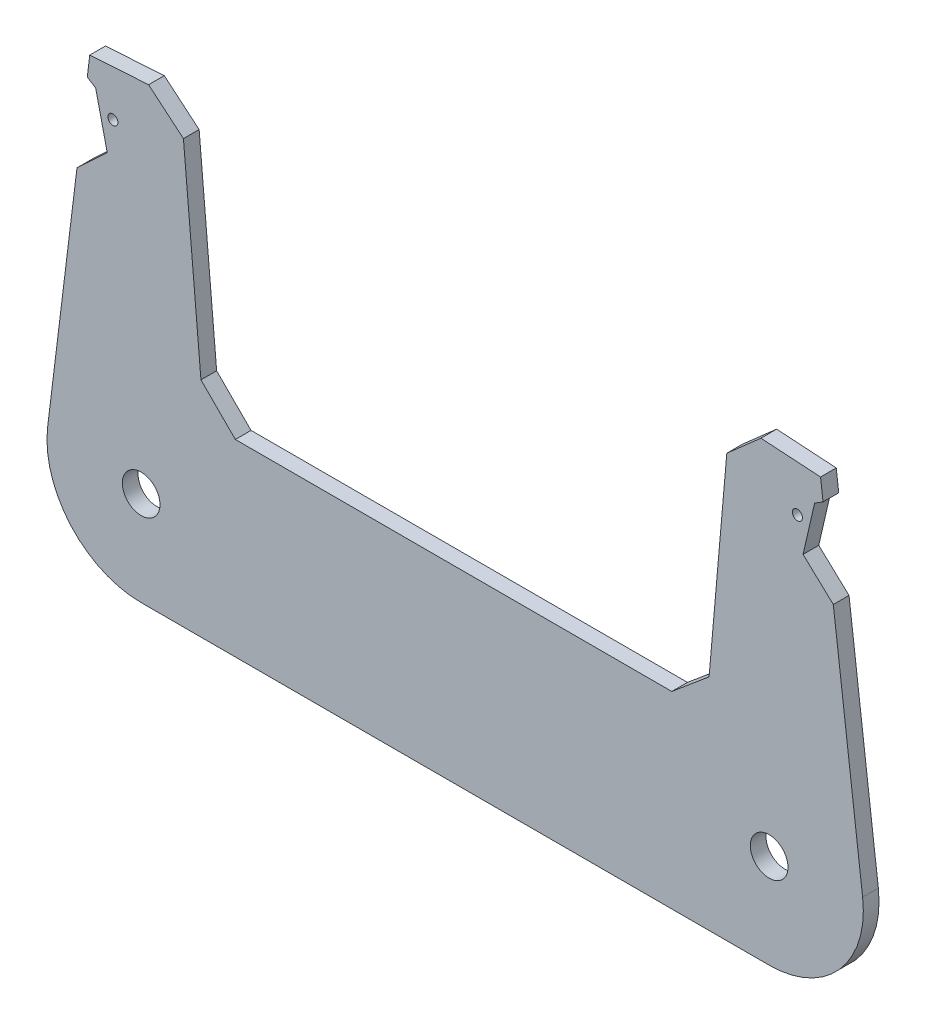
from build123d import *
from OCP.BRepFilletAPI import BRepFilletAPI_MakeChamfer

# Parameters (mm, degrees)
SKETCH1_R           = 6
BOSS_EXTRUDE1_DEPTH = 5
SKETCH2_R           = 1.6
CUT_EXTRUDE1_DEPTH  = 25
CHAMFER1_SIZE       = 10
CHAMFER1_SIZE2      = 10.246835966
CHAMFER2_SIZE       = 10
CHAMFER2_SIZE2      = 11.000628676


with BuildPart() as part:
    # Sketch1 → Boss-Extrude1 (new body)
    with BuildSketch(Plane.XY):
        with BuildLine():
            Line((80, 30), (-80, 30))
            Line((-80, 30), (-87.408238134, 114.676549338))
            Line((-87.408238134, 114.676549338), (-116.370756775, 112.836156983))
            Line((-116.370756775, 112.836156983), (-129.776384549, 3.656080302))
            ThreePointArc((-129.776384549, 3.656080302), (-122.468671624, -19.878601446), (-100, -30))
            Line((-100, -30), (100, -30))
            ThreePointArc((100, -30), (122.468671624, -19.878601446), (129.776384549, 3.656080302))
            Line((129.776384549, 3.656080302), (116.370756775, 112.836156983))
            Line((116.370756775, 112.836156983), (87.408238134, 114.676549338))
            Line((87.408238134, 114.676549338), (80, 30))
        make_face()
        with Locations((-100, 0)):
            Circle(SKETCH1_R, mode=Mode.SUBTRACT)
        with Locations((100, 0)):
            Circle(SKETCH1_R, mode=Mode.SUBTRACT)
    extrude(amount=BOSS_EXTRUDE1_DEPTH)

    # Sketch2 → Cut-Extrude1 (cut)
    with BuildSketch(Plane(origin=(0, 0, 0), x_dir=(-1, 0, 0), z_dir=(0, 0, -1))):
        with Locations((109, 98.696293654)):
            Circle(SKETCH2_R)
        with Locations((-109, 98.696293654)):
            Circle(SKETCH2_R)
        Polygon((120.438781703, 79.704752691), (110.79653452, 88.696293654), (114.490425578, 104.696293654), (117.165001342, 106.367554078), align=None)
        Polygon((-117.165001342, 106.367554078), (-120.438781703, 79.704752691), (-110.79653452, 88.696293654), (-114.490425578, 104.696293654), align=None)
    extrude(amount=-CUT_EXTRUDE1_DEPTH, mode=Mode.SUBTRACT)

    # Chamfer1: one chamfer whose edges measure the first distance from different faces: ONE call of the kernel's chamfer builder (chamfer() names one face for all edges)
    chamfer1_edges_1 = [part.edges().sort_by_distance(p)[0] for p in [
        (-87.408238134, 114.676549338, 2.5),
    ]]
    chamfer1_side_1 = [part.faces().sort_by_distance(p)[0] for p in [
        (-83.704119067, 72.338274669, 2.5),
    ]]
    chamfer1_edges_2 = [part.edges().sort_by_distance(p)[0] for p in [
        (87.408238134, 114.676549338, 2.5),
    ]]
    chamfer1_side_2 = [part.faces().sort_by_distance(p)[0] for p in [
        (101.889497454, 113.75635316, 2.5),
    ]]
    chamfer1 = BRepFilletAPI_MakeChamfer(part.part.solid().wrapped)
    for e in chamfer1_edges_1:
        chamfer1.Add(CHAMFER1_SIZE, CHAMFER1_SIZE2, e.wrapped, chamfer1_side_1[0].wrapped)  # the first distance lies on this face
    for e in chamfer1_edges_2:
        chamfer1.Add(CHAMFER1_SIZE, CHAMFER1_SIZE2, e.wrapped, chamfer1_side_2[0].wrapped)  # the first distance lies on this face
    add(Compound.cast(chamfer1.Shape()), mode=Mode.REPLACE)

    # Chamfer2: one chamfer whose edges measure the first distance from different faces: ONE call of the kernel's chamfer builder (chamfer() names one face for all edges)
    chamfer2_edges_1 = [part.edges().sort_by_distance(p)[0] for p in [
        (-80, 30, 2.5),
    ]]
    chamfer2_side_1 = [part.faces().sort_by_distance(p)[0] for p in [
        (0, 30, 2.5),
    ]]
    chamfer2_edges_2 = [part.edges().sort_by_distance(p)[0] for p in [
        (80, 30, 2.5),
    ]]
    chamfer2_side_2 = [part.faces().sort_by_distance(p)[0] for p in [
        (83.257583767, 67.234352838, 2.5),
    ]]
    chamfer2 = BRepFilletAPI_MakeChamfer(part.part.solid().wrapped)
    for e in chamfer2_edges_1:
        chamfer2.Add(CHAMFER2_SIZE, CHAMFER2_SIZE2, e.wrapped, chamfer2_side_1[0].wrapped)  # the first distance lies on this face
    for e in chamfer2_edges_2:
        chamfer2.Add(CHAMFER2_SIZE, CHAMFER2_SIZE2, e.wrapped, chamfer2_side_2[0].wrapped)  # the first distance lies on this face
    add(Compound.cast(chamfer2.Shape()), mode=Mode.REPLACE)


solid = part.part
